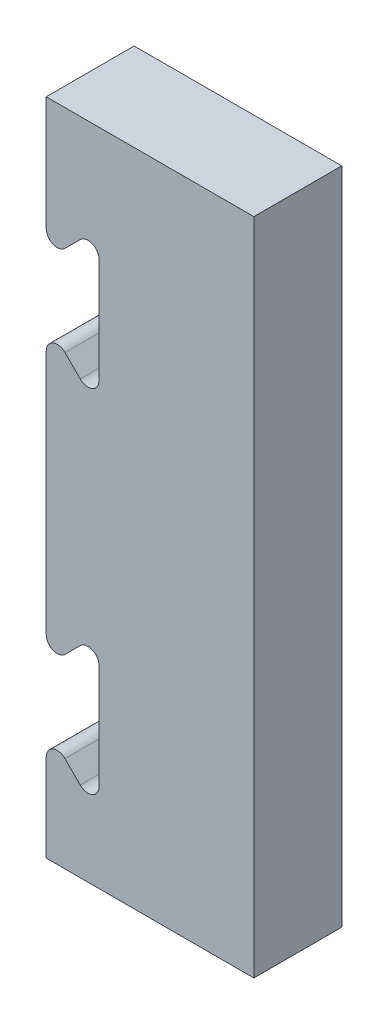
from build123d import *

# Parameters (mm, degrees)
BOSS_EXTRUDE1_DEPTH = 10
BOSS_EXTRUDE2_DEPTH = 6.5
SKETCH4_R           = 3
SKETCH4_R_2         = 3.0000000000000084
CUT_EXTRUDE2_DEPTH  = 10
BOSS_EXTRUDE3_DEPTH = 60
BOSS_EXTRUDE5_DEPTH = 4
CUT_EXTRUDE3_DEPTH  = 186.5693940282179
FILLET2_R           = 3
CUT_EXTRUDE4_DEPTH  = 187.81541692269406
FILLET3_R           = 1.25
SKETCH9_OUTSIDE_W   = 170.05200000000002
SKETCH9_OUTSIDE_H   = 160.05200000000002
SKETCH9_OUTSIDE_W_2 = 23.614386219061117
SKETCH9_OUTSIDE_H_2 = 74.99999999999999
CUT_EXTRUDE6_DEPTH  = 10
CUT_EXTRUDE7_DEPTH  = 60


with BuildPart() as part:
    # Sketch2 → Boss-Extrude1 (new body)
    with BuildSketch(Plane.XY):
        Polygon((0, 0), (130, 0), (130, 14), (75, 69), (75, 120.00000000000001), (-2.45e-15, 120), align=None)
    extrude(amount=-BOSS_EXTRUDE1_DEPTH)

    # Sketch3 → Boss-Extrude2 (add)
    with BuildSketch(Plane.XY):
        Polygon((-2.45e-15, 120), (75, 120), (75, 116.99999999999999), (-2.08e-15, 117), align=None)
        Polygon((-2.45e-15, 80.99999999999999), (75, 80.99999999999999), (75, 77.99999999999999), (-2.08e-15, 77.99999999999999), align=None)
    extrude(amount=BOSS_EXTRUDE2_DEPTH)

    # Sketch4 → Cut-Extrude2 (cut)
    with BuildSketch(Plane.XY):
        with Locations((10.000000000000002, 98.99999999999999)):
            Circle(SKETCH4_R)
        with Locations((65, 98.99999999999997)):
            Circle(SKETCH4_R_2)
    extrude(amount=-CUT_EXTRUDE2_DEPTH, mode=Mode.SUBTRACT)

    # Sketch5 → Boss-Extrude3 (add)
    with BuildSketch(Plane.XY):
        Polygon((130, 14), (104.00000000000001, 13.999999999999995), (104.00000000000001, 4.78e-15), (130, 0), align=None)
        Polygon((7.999999999999998, 0), (34, 0), (34, 13.999999999999995), (7.999999999999993, 14), align=None)
    extrude(amount=BOSS_EXTRUDE3_DEPTH)

    # Sketch7 → Boss-Extrude5 (add)
    with BuildSketch(Plane.XY):
        with BuildLine():
            Line((52.99999999999999, 13.00000000000001), (53, 60.00000000000001))
            ThreePointArc((53, 60.00000000000001), (60, 67), (67, 60.00000000000001))
            Line((67, 60.00000000000001), (67, 13.00000000000001))
            ThreePointArc((67, 13.00000000000001), (60, 6.0000000000000036), (52.99999999999999, 13.00000000000001))
        make_face()
    extrude(amount=BOSS_EXTRUDE5_DEPTH)

    # Sketch8 → Cut-Extrude3 (cut, through all)
    with BuildSketch(Plane.XY.offset(4)):
        with BuildLine():
            Line((62.2, 13.00000000000001), (62.2, 60.00000000000001))
            ThreePointArc((62.2, 60.00000000000001), (60, 62.20000000000001), (57.8, 60.00000000000001))
            Line((57.8, 60.00000000000001), (57.79999999999999, 13.00000000000001))
            ThreePointArc((57.79999999999999, 13.00000000000001), (60, 10.8), (62.2, 13.00000000000001))
        make_face()
    extrude(amount=-CUT_EXTRUDE3_DEPTH, mode=Mode.SUBTRACT)

    # Fillet2
    fillet2_edges = [part.edges().sort_by_distance(p)[0] for p in [
        (75, 120, -1.75),
        (-2.45e-15, 120, -1.75),
        (37.5, 77.99999999999999, 0),
        (75, 69, -5),
    ]]
    fillet(fillet2_edges, radius=FILLET2_R)

    # Sketch6 → Cut-Extrude4 (cut, through all)
    with BuildSketch(Plane.XY):
        Polygon((-2.08e-15, 13.000000000000002), (5.999999999999998, 6.999999999999992), (5.999999999999998, 24.999999999999993), (-2.82e-15, 19), align=None)
        Polygon((5.999999999999998, 47), (-4.68e-15, 52.99999999999999), (-4.68e-15, 59), (5.999999999999998, 65), align=None)
    extrude(amount=-CUT_EXTRUDE4_DEPTH, mode=Mode.SUBTRACT)

    # Fillet3
    fillet3_edges = [part.edges().sort_by_distance(p)[0] for p in [
        (-2.08e-15, 13.000000000000002, -5),
        (-2.82e-15, 19, -5),
        (5.999999999999998, 24.999999999999993, -5),
        (5.999999999999998, 6.999999999999992, -5),
        (5.999999999999998, 65, -5),
        (5.999999999999998, 47, -5),
        (-4.68e-15, 52.99999999999999, -5),
        (-4.68e-15, 59, -5),
    ]]
    fillet(fillet3_edges, radius=FILLET3_R)

    # Sketch9 outside → Cut-Extrude6 (cut)
    with BuildSketch(Plane.XY):
        with Locations((65, 60.00000000000001)):
            Rectangle(SKETCH9_OUTSIDE_W, SKETCH9_OUTSIDE_H)
        with Locations((11.807193109530559, 37.49999999999999)):
            Rectangle(SKETCH9_OUTSIDE_W_2, SKETCH9_OUTSIDE_H_2, mode=Mode.SUBTRACT)
    extrude(amount=-CUT_EXTRUDE6_DEPTH, mode=Mode.SUBTRACT)


with BuildPart() as body_2:
    # of the pieces the cut leaves, the one that is kept (cut_extrude6_keep)
    add(part.part.solids().sort_by_distance((0, 62.017766953, 0))[0])

    # Sketch10 → Cut-Extrude7 (cut)
    with BuildSketch(Plane.XY.offset(60)):
        Polygon((7.999999999999993, 14), (7.999999999999998, 0), (34, 0), (34, 13.999999999999995), align=None)
    extrude(amount=-CUT_EXTRUDE7_DEPTH, mode=Mode.SUBTRACT)


solid = body_2.part
